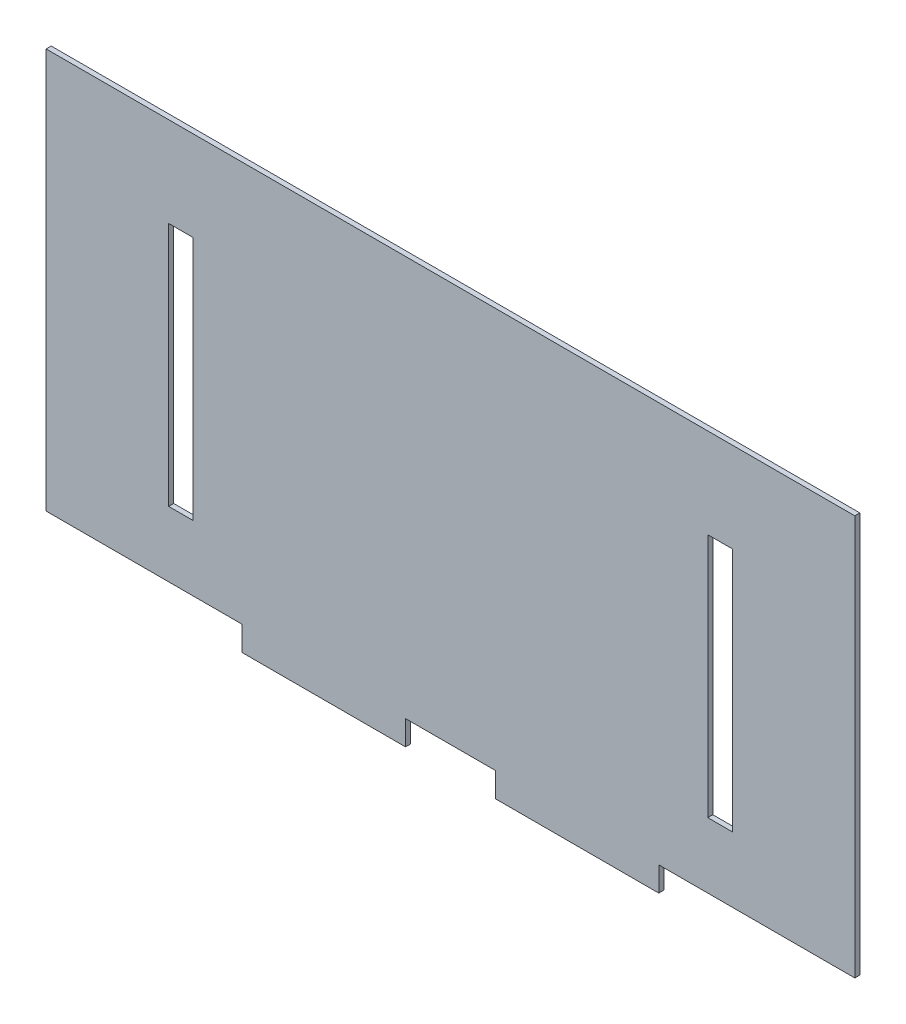
from build123d import *

# Parameters (mm, degrees)
SKETCH1_W           = 14.524880194
SKETCH1_H           = 145.1987794
SKETCH1_W_2         = 14.523212776
BOSS_EXTRUDE1_DEPTH = 3


with BuildPart() as part:
    # Sketch1 → Boss-Extrude1 (new body)
    with BuildSketch(Plane.XY):
        Polygon((489.722179652, 1088.669270914), (373.559821295, 1088.669270914), (373.559821295, 1074.149392974), (276.759523416, 1074.149392974), (276.759523416, 1088.669270914), (223.522194194, 1088.669270914), (223.522194194, 1074.149392974), (126.721896315, 1074.149392974), (126.721896315, 1088.669270914), (10.562872795, 1088.669270914), (10.562872795, 1325.819495982), (489.722179652, 1325.819495982), align=None)
        with Locations((409.860349854, 1199.981109641)):
            Rectangle(SKETCH1_W, SKETCH1_H, mode=Mode.SUBTRACT)
        with Locations((90.422201465, 1199.981109641)):
            Rectangle(SKETCH1_W_2, SKETCH1_H, mode=Mode.SUBTRACT)
    extrude(amount=BOSS_EXTRUDE1_DEPTH)


solid = part.part
